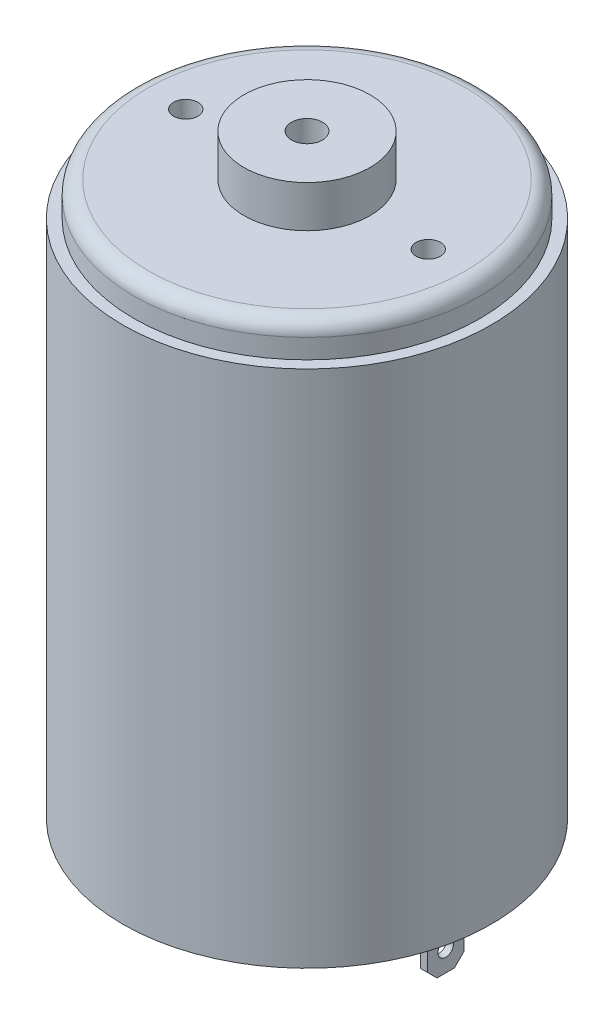
from build123d import *

# Parameters (mm, degrees)
ENL_V_MAT_EXTRU_1_DEPTH                   = 15
TROU_TARAUD_M31_D                         = 2.5
TROU_TARAUD_M31_DEPTH                     = 8.5
TROU_TARAUD_M31_TIP                       = 0.751075774
ESQUISSE5_W                               = 0.7
ESQUISSE5_H                               = 3.8
BOSS_EXTRU_1_DEPTH                        = 6.7
CHANFREIN1_SIZE                           = 1
ESQUISSE6_R                               = 0.8
ENL_V_MAT_EXTRU_2_DEPTH                   = 6.7
R_P_TITION_CIRCULAIRE1_COUNT              = 2
CHANFREIN1_OF_R_P_TITION_CIRCULAIRE1_SIZE = 1
ESQUISSE7_R                               = 1.6
ENL_V_MAT_EXTRU_3_DEPTH                   = 90.145947749


with BuildPart() as part:
    # Esquisse1 → Révolution1 (revolve)
    with BuildSketch(Plane.XY, mode=Mode.PRIVATE) as r_volution1_sk:
        with BuildLine():
            Line((0, 0), (-1.6, 0))
            Line((-1.6, 0), (-1.6, 2.6))
            Line((-1.6, 2.6), (-5.075, 2.6))
            Line((-5.075, 2.6), (-5.075, 4.5))
            Line((-5.075, 4.5), (-19, 4.5))
            Line((-19, 4.5), (-19, 58))
            Line((-19, 58), (-17.85, 58))
            Line((-17.85, 58), (-17.85, 60))
            ThreePointArc((-17.85, 60), (-17.410660172, 61.060660172), (-16.35, 61.5))
            Line((-16.35, 61.5), (-6.5, 61.5))
            Line((-6.5, 61.5), (-6.5, 65.8))
            Line((-6.5, 65.8), (-1.6, 65.8))
            Line((-1.6, 65.8), (-1.6, 85))
            Line((-1.6, 85), (0, 85))
            Line((0, 85), (0, 0))
        make_face()
    revolve(r_volution1_sk.sketch.rotate(Axis((0, 0, 0), (0, 1, 0)), 270), axis=Axis((0, 0, 0), (0, 1, 0)))

    # Esquisse2 → Enlèv. mat.-Extru.1 (cut)
    with BuildSketch(Plane(origin=(0, 85, 0), x_dir=(1, 0, 0), z_dir=(0, 1, 0))):
        with BuildLine():
            Line((-1.161895004, -1.1), (1.161895004, -1.1))
            ThreePointArc((1.161895004, -1.1), (0, -1.6), (-1.161895004, -1.1))
        make_face()
    extrude(amount=-ENL_V_MAT_EXTRU_1_DEPTH, mode=Mode.SUBTRACT)

    # Trou taraudé M31
    with Locations(Plane(origin=(0, 61.5, 0), x_dir=(-1, 0, 0), z_dir=(0, 1, 0))):
        with Locations((12.5, 0), (-12.5, 0)):
            Hole(TROU_TARAUD_M31_D / 2, depth=TROU_TARAUD_M31_DEPTH)
            with Locations((0, 0, -(TROU_TARAUD_M31_DEPTH + TROU_TARAUD_M31_TIP / 2))):  # 118° drill point
                Cone(0, TROU_TARAUD_M31_D / 2, TROU_TARAUD_M31_TIP, mode=Mode.SUBTRACT)

    # Esquisse5 → Boss.-Extru.1 (add)
    with BuildSketch(Plane.XZ.offset(-4.5)):
        with Locations((-13.95, 0)):
            Rectangle(ESQUISSE5_W, ESQUISSE5_H)
    boss_extru_1 = extrude(amount=BOSS_EXTRU_1_DEPTH)

    # Chanfrein1
    chanfrein1_edges = [part.edges().sort_by_distance(p)[0] for p in [
        (-13.95, -2.2, -1.9),
        (-13.95, -2.2, 1.9),
    ]]
    chamfer(chanfrein1_edges, length=CHANFREIN1_SIZE)

    # Esquisse6 → Enlèv. mat.-Extru.2 (cut)
    with BuildSketch(Plane.ZY.offset(14.3)):
        Circle(ESQUISSE6_R)
    enl_v_mat_extru_2 = extrude(amount=-ENL_V_MAT_EXTRU_2_DEPTH, mode=Mode.SUBTRACT)

    # Répétition circulaire1: Boss.-Extru.1, Enlèv. mat.-Extru.2 ×2 about axis
    r_p_tition_circulaire1_axis = Axis((0, 0, 0), (0, 1, 0))
    add([boss_extru_1.rotate(r_p_tition_circulaire1_axis, i * 360 / R_P_TITION_CIRCULAIRE1_COUNT) for i in range(1, R_P_TITION_CIRCULAIRE1_COUNT)])
    add([enl_v_mat_extru_2.rotate(r_p_tition_circulaire1_axis, i * 360 / R_P_TITION_CIRCULAIRE1_COUNT) for i in range(1, R_P_TITION_CIRCULAIRE1_COUNT)], mode=Mode.SUBTRACT)

    # Chanfrein1 of Répétition circulaire1
    chanfrein1_of_r_p_tition_circulaire1_edges = [part.edges().sort_by_distance(p)[0] for p in [
        (13.95, -2.2, 1.9),
        (13.95, -2.2, -1.9),
    ]]
    chamfer(chanfrein1_of_r_p_tition_circulaire1_edges, length=CHANFREIN1_OF_R_P_TITION_CIRCULAIRE1_SIZE)

    # Esquisse7 → Enlèv. mat.-Extru.3 (cut, through all)
    with BuildSketch(Plane.XZ):
        with Locations(Location((0, 0, 0), (0, 0, 270))):
            Circle(ESQUISSE7_R)
    extrude(amount=-ENL_V_MAT_EXTRU_3_DEPTH, mode=Mode.SUBTRACT)


solid = part.part
